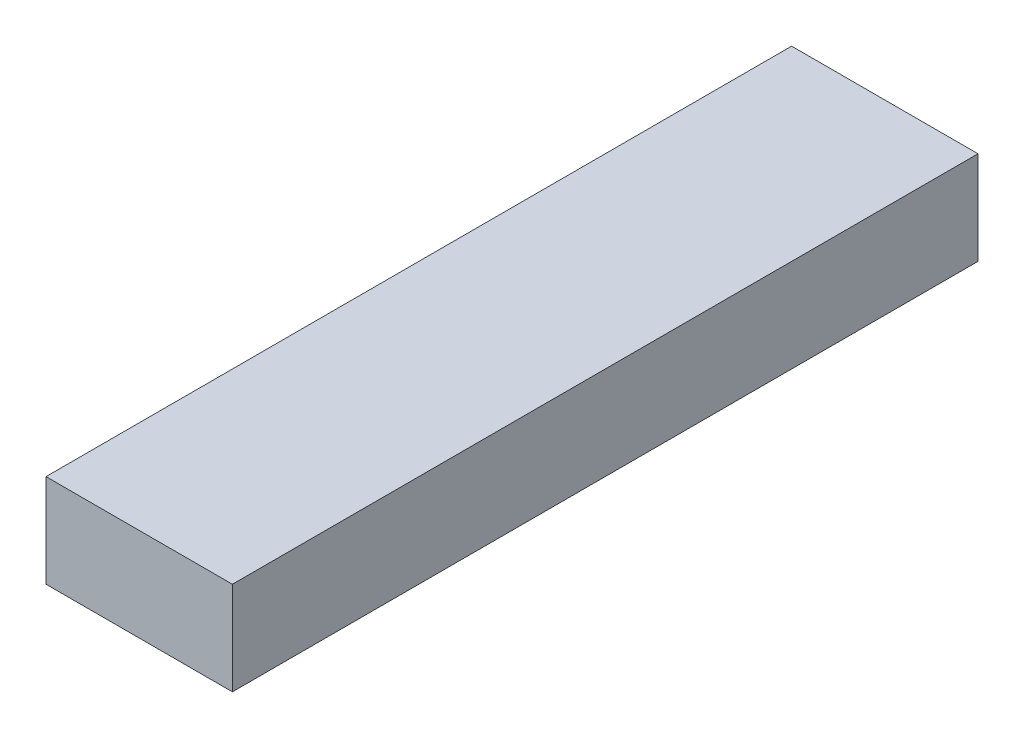
from build123d import *

# Parameters (mm, degrees)
PROFILE1_W = 10
PROFILE1_H = 5


with BuildPart() as part:
    # sweep_profile_rect: sweep along a path in Path1
    with BuildLine(Plane(origin=(0, 0, 0), x_dir=(0, 0, -1), z_dir=(1, 0, 0))) as sweep_profile_rect_path:
        Line((0, 0), (-40, 0))
    # Profile1 → sweep_profile_rect (sweep)
    with BuildSketch(Plane.XY):
        Rectangle(PROFILE1_W, PROFILE1_H)
    sweep(path=sweep_profile_rect_path.line)


solid = part.part
